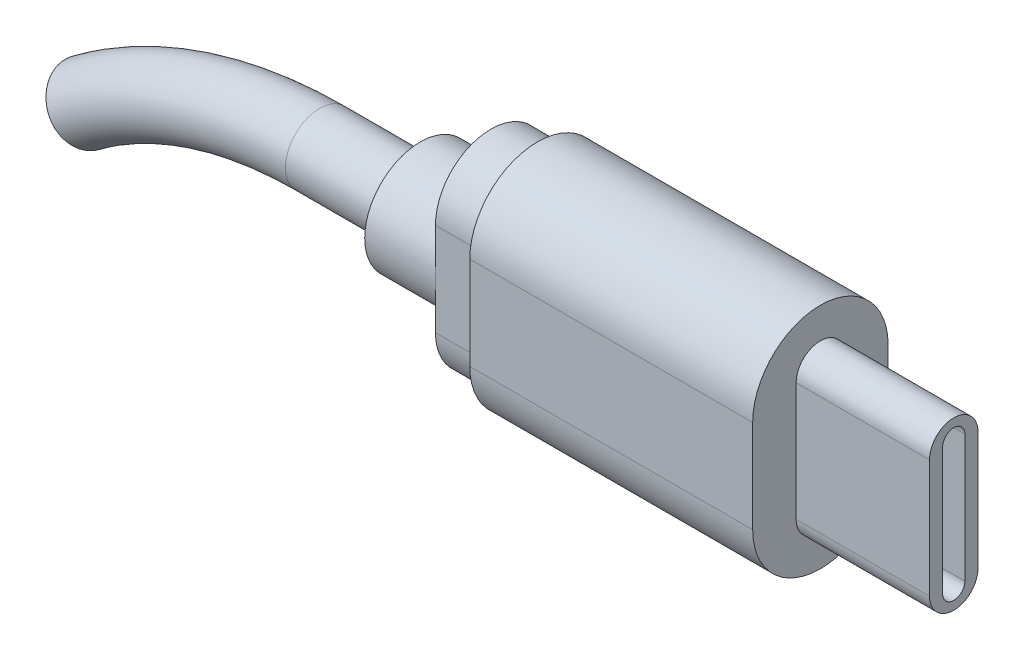
from build123d import *

# Parameters (mm, degrees)
EXTRUDE_1_DEPTH = 14
EXTRUDE_2_DEPTH = 2.3
SKETCH_4_R      = 2.75
EXTRUDE_3_DEPTH = 3.5
SKETCH_5_R      = 1.7
EXTRUDE_4_DEPTH = 6.6


with BuildPart() as part:
    # Эскиз1 → Бобышка-Вытянуть1 (new body)
    with BuildSketch(Plane(origin=(0, 0, 0), x_dir=(0, 0, -1), z_dir=(1, 0, 0))):
        with BuildLine():
            Line((-3.35, -2.3), (-3.35, 2.3))
            ThreePointArc((-3.35, 2.3), (0, 5.65), (3.35, 2.3))
            Line((3.35, 2.3), (3.35, -2.3))
            ThreePointArc((3.35, -2.3), (0, -5.65), (-3.35, -2.3))
        make_face()
    extrude(amount=-EXTRUDE_1_DEPTH)

    # Эскиз3 → Бобышка-Вытянуть2 (add)
    with BuildSketch(Plane.ZY.offset(14)):
        with BuildLine():
            Line((2.75, 2.3), (2.75, -2.3))
            ThreePointArc((2.75, -2.3), (0, -5.05), (-2.75, -2.3))
            Line((-2.75, -2.3), (-2.75, 2.3))
            ThreePointArc((-2.75, 2.3), (0, 5.05), (2.75, 2.3))
        make_face()
    extrude(amount=EXTRUDE_2_DEPTH)

    # Эскиз4 → Бобышка-Вытянуть3 (add)
    with BuildSketch(Plane.ZY.offset(16.3)):
        Circle(SKETCH_4_R)
    extrude(amount=EXTRUDE_3_DEPTH)

    # По траектории1: sweep along a path in Эскиз6
    with BuildLine(Plane.XY) as sweep_1_path:
        Line((-19.8, 0), (-24.776161806, 0))
        ThreePointArc((-24.776161806, 0), (-30.870449905, -0.986593903), (-36.342181829, -3.845591055))
    # Эскиз5 → По траектории1 (sweep)
    with BuildSketch(Plane.ZY.offset(19.8)):
        Circle(SKETCH_5_R)
    sweep(path=sweep_1_path.line)

    # Эскиз7 → Бобышка-Вытянуть4 (add)
    with BuildSketch(Plane(origin=(0, 0, 0), x_dir=(0, 0, -1), z_dir=(1, 0, 0))):
        with BuildLine():
            Line((-1.2, -2.925), (-1.2, 2.925))
            ThreePointArc((-1.2, 2.925), (0, 4.125), (1.2, 2.925))
            Line((1.2, 2.925), (1.2, -2.925))
            ThreePointArc((1.2, -2.925), (0, -4.125), (-1.2, -2.925))
        make_face()
        with BuildLine():
            Line((-0.55, -3.15), (-0.55, 3.15))
            ThreePointArc((-0.55, 3.15), (0, 3.7), (0.55, 3.15))
            Line((0.55, 3.15), (0.55, -3.15))
            ThreePointArc((0.55, -3.15), (0, -3.7), (-0.55, -3.15))
        make_face(mode=Mode.SUBTRACT)
    extrude(amount=EXTRUDE_4_DEPTH)


solid = part.part
